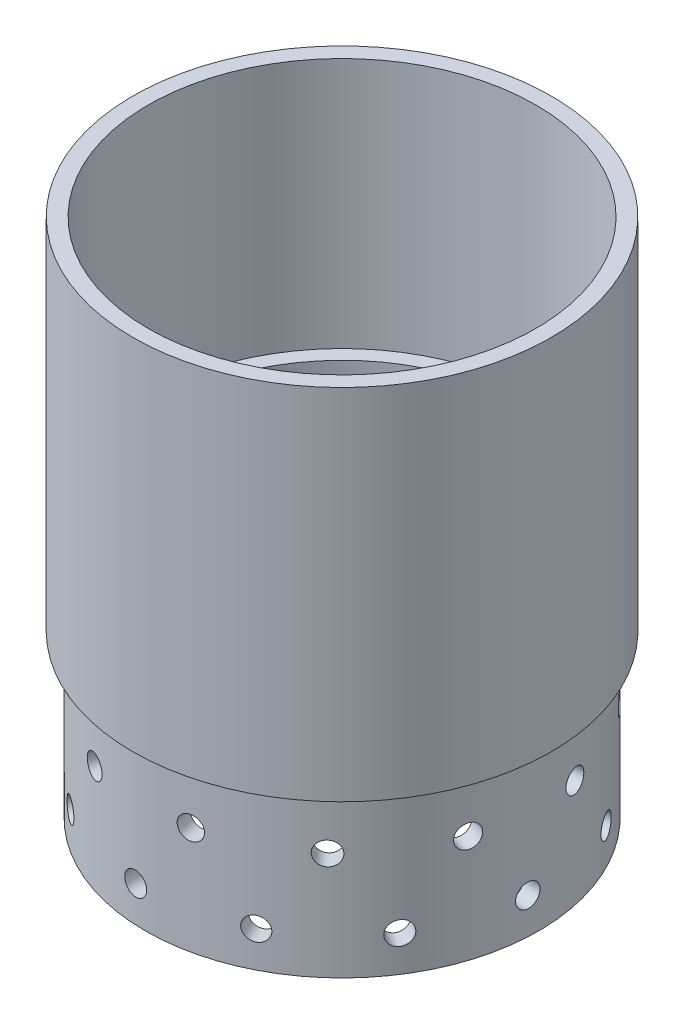
from build123d import *

# Parameters (mm, degrees)
SKETCH1_R           = 69.596
SKETCH1_R_2         = 63.5
BOSS_EXTRUDE1_DEPTH = 57.15
CUT_EXTRUDE2_REACH  = 175.215
SKETCH3_R           = 4.1021
CIRPATTERN2_COUNT   = 12
SKETCH5_R           = 74.041
SKETCH5_R_2         = 63.5
BOSS_EXTRUDE3_DEPTH = 127
CUT_EXTRUDE3_REACH  = 254.933
SKETCH7_R           = 4.1021
CIRPATTERN3_COUNT   = 12
CUT_EXTRUDE4_START  = -88.9
SKETCH8_R           = 68.58
SKETCH8_R_2         = 63.5
CUT_EXTRUDE4_DEPTH  = 88.9


with BuildPart() as part:
    # Sketch1 → Boss-Extrude1 (new body)
    with BuildSketch(Plane(origin=(0, 0, 0), x_dir=(1, 0, 0), z_dir=(0, 1, 0))):
        Circle(SKETCH1_R)
        Circle(SKETCH1_R_2, mode=Mode.SUBTRACT)
    extrude(amount=BOSS_EXTRUDE1_DEPTH)

    # Sketch3 → Cut-Extrude2 (cut, up to next)
    with BuildSketch(Plane(origin=(-21.506346741, 0, 66.189729308), x_dir=(0, -1, 0), z_dir=(-0.3090169943749482, 0, 0.9510565162951534)), mode=Mode.PRIVATE) as cut_extrude2_sk1:
        with Locations((-38.1, 0)):
            Circle(SKETCH3_R)
    cut_extrude2_tool1 = extrude(cut_extrude2_sk1.sketch, amount=-CUT_EXTRUDE2_REACH, mode=Mode.PRIVATE) & part.part
    cut_extrude2 = cut_extrude2_tool1.solids().sort_by_distance((-21.506347, 38.1, 66.189729))[0]
    add(cut_extrude2, mode=Mode.SUBTRACT)

    # CirPattern2: Cut-Extrude2 ×12 about axis
    cirpattern2_axis = Axis((0, 57.15, 0), (0, -1, 0))
    for i in range(1, CIRPATTERN2_COUNT):
        add(cut_extrude2.rotate(cirpattern2_axis, i * 360 / CIRPATTERN2_COUNT), mode=Mode.SUBTRACT)

    # Sketch5 → Boss-Extrude3 (add)
    with BuildSketch(Plane(origin=(0, 57.15, 0), x_dir=(1, 0, 0), z_dir=(0, 1, 0))):
        Circle(SKETCH5_R)
        Circle(SKETCH5_R_2, mode=Mode.SUBTRACT)
    extrude(amount=BOSS_EXTRUDE3_DEPTH)

    # Sketch7 → Cut-Extrude3 (cut, up to next)
    with BuildSketch(Plane(origin=(37.904698281, 0, -58.368116847), x_dir=(0, -1, 0), z_dir=(0.5446390350150282, 0, -0.8386705679454233)), mode=Mode.PRIVATE) as cut_extrude3_sk1:
        with Locations((-12.7, 0)):
            Circle(SKETCH7_R)
    cut_extrude3_tool1 = extrude(cut_extrude3_sk1.sketch, amount=-CUT_EXTRUDE3_REACH, mode=Mode.PRIVATE) & part.part
    cut_extrude3 = cut_extrude3_tool1.solids().sort_by_distance((37.904698, 12.7, -58.368117))[0]
    add(cut_extrude3, mode=Mode.SUBTRACT)

    # CirPattern3: Cut-Extrude3 ×12 about axis
    cirpattern3_axis = Axis((0, 57.15, 0), (0, -1, 0))
    for i in range(1, CIRPATTERN3_COUNT):
        add(cut_extrude3.rotate(cirpattern3_axis, i * 360 / CIRPATTERN3_COUNT), mode=Mode.SUBTRACT)

    # Sketch8 → Cut-Extrude4 (cut)
    with BuildSketch(Plane(origin=(0, 184.15, 0), x_dir=(1, 0, 0), z_dir=(0, 1, 0)).offset(CUT_EXTRUDE4_START)):
        Circle(SKETCH8_R)
        Circle(SKETCH8_R_2, mode=Mode.SUBTRACT)
    extrude(amount=CUT_EXTRUDE4_DEPTH, mode=Mode.SUBTRACT)


solid = part.part
